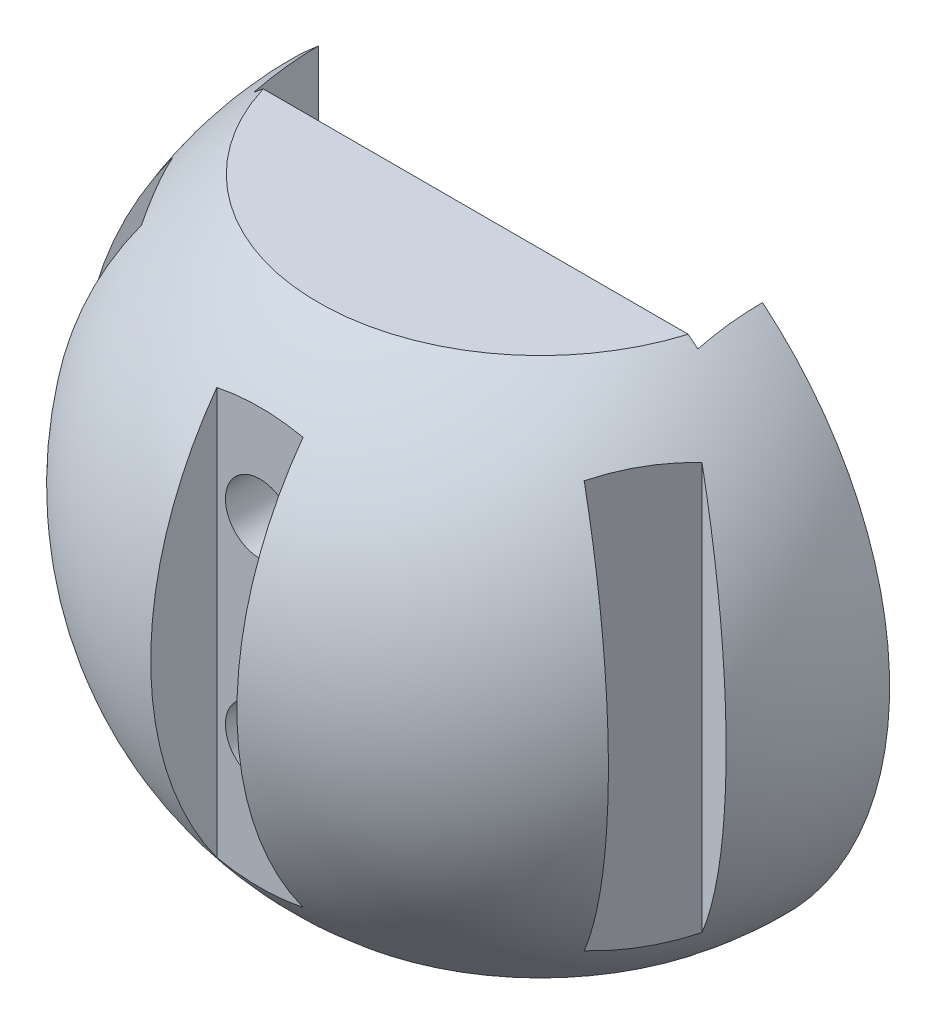
from build123d import *

# Parameters (mm, degrees)
REVOLVE6_ANGLE     = 180
CUT_EXTRUDE3_DEPTH = 34.397155568
SKETCH6_W          = 20.606544016
SKETCH6_H          = 25.002606738
CUT_EXTRUDE4_DEPTH = 3
SKETCH15_W         = 5.12502067
SKETCH15_H         = 26.452748528
CUT_EXTRUDE7_DEPTH = 2
CIRPATTERN1_COUNT  = 6
SKETCH20_R         = 1.6
CUT_EXTRUDE8_DEPTH = 30.260079699


with BuildPart() as part:
    # Sketch1 → Revolve6 (revolve)
    with BuildSketch(Plane.XY):
        with BuildLine():
            Line((0, 24.3), (0, -8.1))
            ThreePointArc((0, -8.1), (16.2, 8.1), (0, 24.3))
        make_face()
    revolve(axis=Axis((0, 24.3, 0), (0, -1, 0)), revolution_arc=REVOLVE6_ANGLE)

    # Sketch7 → Cut-Extrude3 (cut, through all)
    with BuildSketch(Plane(origin=(0, 0, 0), x_dir=(-1, 0, 0), z_dir=(0, 0, -1))):
        with BuildLine():
            Line((-10.303272008, 20.601303369), (10.303272008, 20.601303369))
            ThreePointArc((10.303272008, 20.601303369), (0, 24.3), (-10.303272008, 20.601303369))
        make_face()
        with BuildLine():
            Line((-10.303272008, -4.401303369), (10.303272008, -4.401303369))
            ThreePointArc((10.303272008, -4.401303369), (0, -8.1), (-10.303272008, -4.401303369))
        make_face()
    extrude(amount=-CUT_EXTRUDE3_DEPTH, mode=Mode.SUBTRACT)

    # Sketch6 → Cut-Extrude4 (cut)
    with BuildSketch(Plane(origin=(0, 0, 0), x_dir=(-1, 0, 0), z_dir=(0, 0, -1))):
        with Locations((0, 8.1)):
            Rectangle(SKETCH6_W, SKETCH6_H)
    extrude(amount=-CUT_EXTRUDE4_DEPTH, mode=Mode.SUBTRACT)

    # Sketch15 → Cut-Extrude7 (cut, symmetric)
    with BuildSketch(Plane(origin=(0, 0, 0), x_dir=(0, 0, -1), z_dir=(1, 0, 0))):
        with Locations((-15.573988478, 7.374929105)):
            Rectangle(SKETCH15_W, SKETCH15_H)
    cut_extrude7 = extrude(amount=CUT_EXTRUDE7_DEPTH, both=True, mode=Mode.SUBTRACT)

    # CirPattern1: Cut-Extrude7 ×6 about axis
    cirpattern1_axis = Axis((0, 0, 0), (0, 1, 0))
    for i in range(1, CIRPATTERN1_COUNT):
        add(cut_extrude7.rotate(cirpattern1_axis, i * 360 / CIRPATTERN1_COUNT), mode=Mode.SUBTRACT)

    # Sketch20 → Cut-Extrude8 (cut, through all)
    with BuildSketch(Plane.XY.offset(13.011478143)):
        with Locations((0, 13.267578614)):
            Circle(SKETCH20_R)
        with Locations((0, 4.215406421)):
            Circle(SKETCH20_R)
    extrude(amount=-CUT_EXTRUDE8_DEPTH, mode=Mode.SUBTRACT)


solid = part.part
